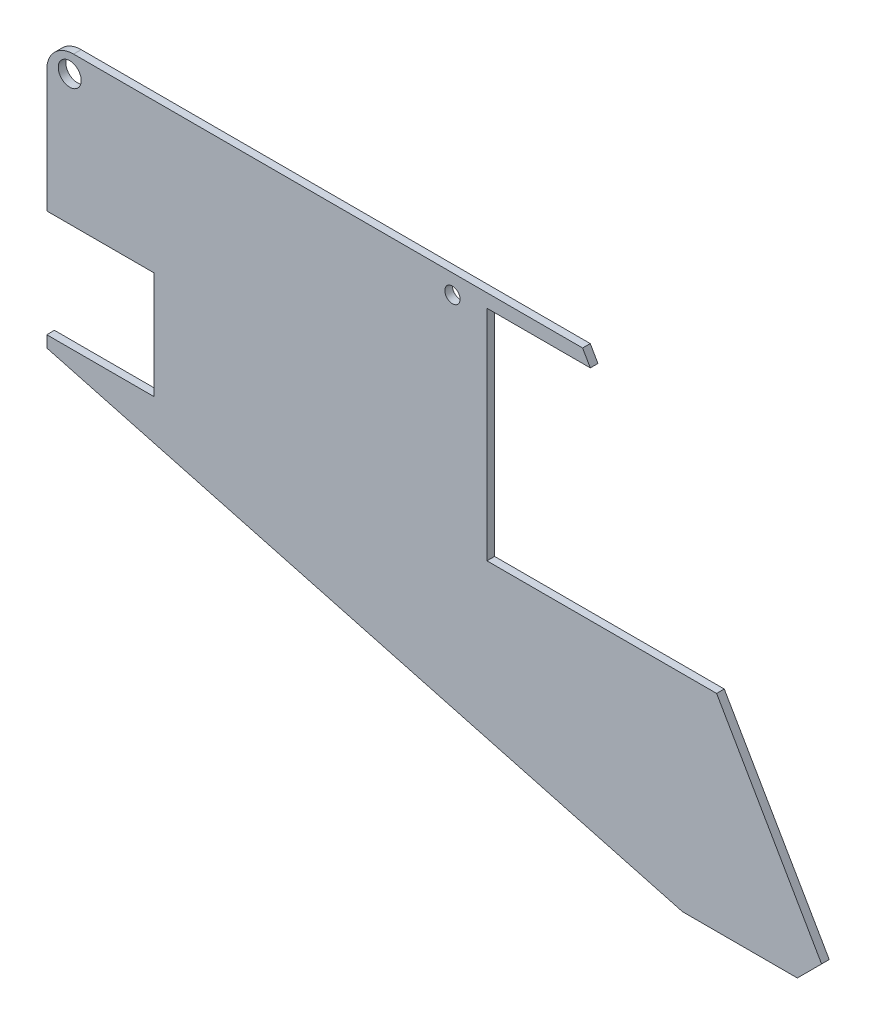
from build123d import *

# Parameters (mm, degrees)
SKETCH1_W           = 700
SKETCH1_H           = 350
BOSS_EXTRUDE2_DEPTH = 5
SKETCH2_R           = 15
SKETCH2_R_2         = 10
CUT_EXTRUDE1_DEPTH  = 10
FILLET1_R           = 35
SKETCH3_W           = 140
SKETCH3_H           = 140
CUT_EXTRUDE2_DEPTH  = 789.23060426
CHAMFER1_SIZE       = 50
CHAMFER1_SIZE2      = 36.602540378


with BuildPart() as part:
    # Sketch1 → Boss-Extrude2 (new, symmetric)
    with BuildSketch(Plane.XY):
        Polygon((350, -175), (-350, -175), (480.560796608, -397.548094716), (680.560796608, -397.548094716), (350, 175), align=None)
        Rectangle(SKETCH1_W, SKETCH1_H)
    extrude(amount=BOSS_EXTRUDE2_DEPTH, both=True)

    # Sketch2 → Cut-Extrude1 (cut)
    with BuildSketch(Plane.XY.offset(5)):
        with Locations((-320, 150)):
            Circle(SKETCH2_R)
        with Locations((180, 150)):
            Circle(SKETCH2_R_2)
    extrude(amount=-CUT_EXTRUDE1_DEPTH, mode=Mode.SUBTRACT)

    # Fillet1
    fillet1_edges = [part.edges().sort_by_distance(p)[0] for p in [
        (-350, 175, 0),
    ]]
    fillet(fillet1_edges, radius=FILLET1_R)

    # Sketch3 → Cut-Extrude2 (cut, through all)
    with BuildSketch(Plane.XY.offset(5)):
        with Locations((-280, -90)):
            Rectangle(SKETCH3_W, SKETCH3_H)
        Polygon((225.111069989, 157.48711306), (225.111069989, -128.301270189), (525.111069989, -128.301270189), (360.111069989, 157.48711306), align=None)
    extrude(amount=-CUT_EXTRUDE2_DEPTH, mode=Mode.SUBTRACT)

    # Chamfer1
    chamfer1_edges = [part.edges().sort_by_distance(p)[0] for p in [
        (680.560796608, -397.548094716, 0),
    ]]
    chamfer1_side = [part.faces().sort_by_distance(p)[0] for p in [
        (580.560796608, -397.548094716, 0),
    ]]
    chamfer(chamfer1_edges, length=CHAMFER1_SIZE, length2=CHAMFER1_SIZE2, reference=chamfer1_side[0])


solid = part.part
